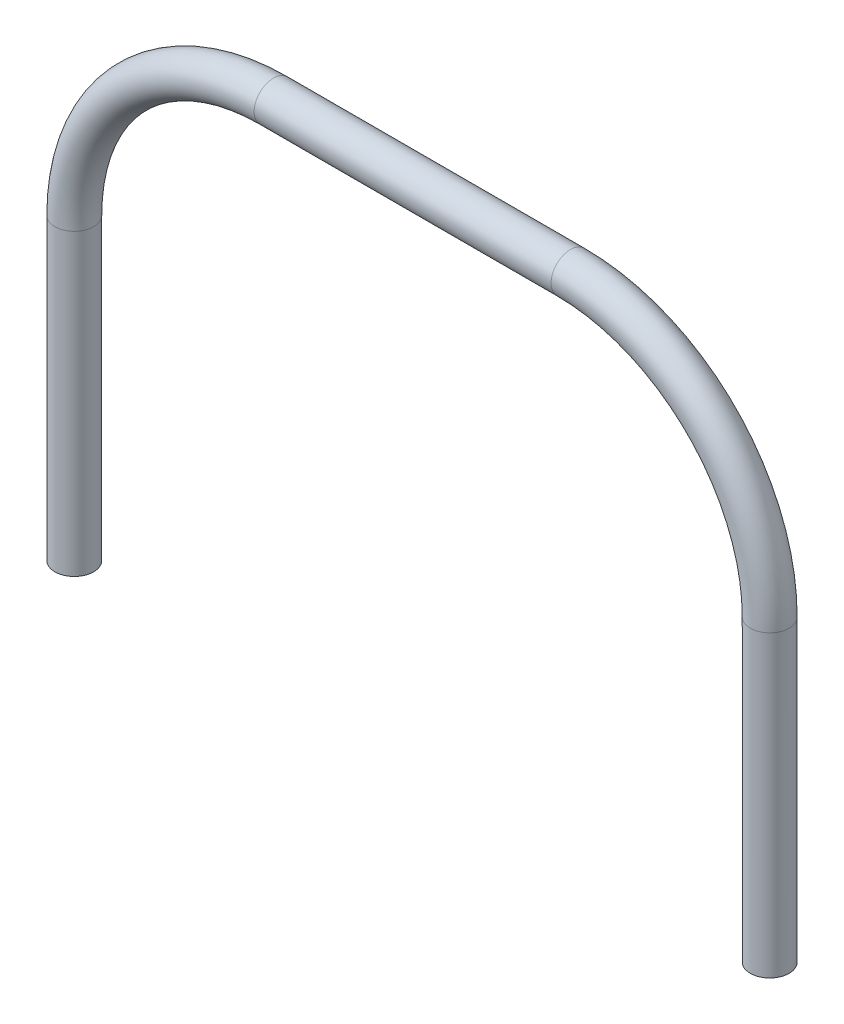
from build123d import *

# Parameters (mm, degrees)
CROQUIS2_R = 9.75


with BuildPart() as part:
    # Barrer1: sweep along a path in Croquis1
    with BuildLine(Plane.XY) as barrer1_path:
        Line((0, 0), (0, 150))
        ThreePointArc((0, 150), (29.289321881, 220.710678119), (100, 250))
        Line((100, 250), (249, 250))
        ThreePointArc((249, 250), (319.710678119, 220.710678119), (349, 150))
        Line((349, 150), (349, 0))
    # Croquis2 → Barrer1 (sweep)
    with BuildSketch(Plane(origin=(0, 0, 0), x_dir=(1, 0, 0), z_dir=(0, 1, 0))):
        Circle(CROQUIS2_R)
    sweep(path=barrer1_path.line)


solid = part.part
